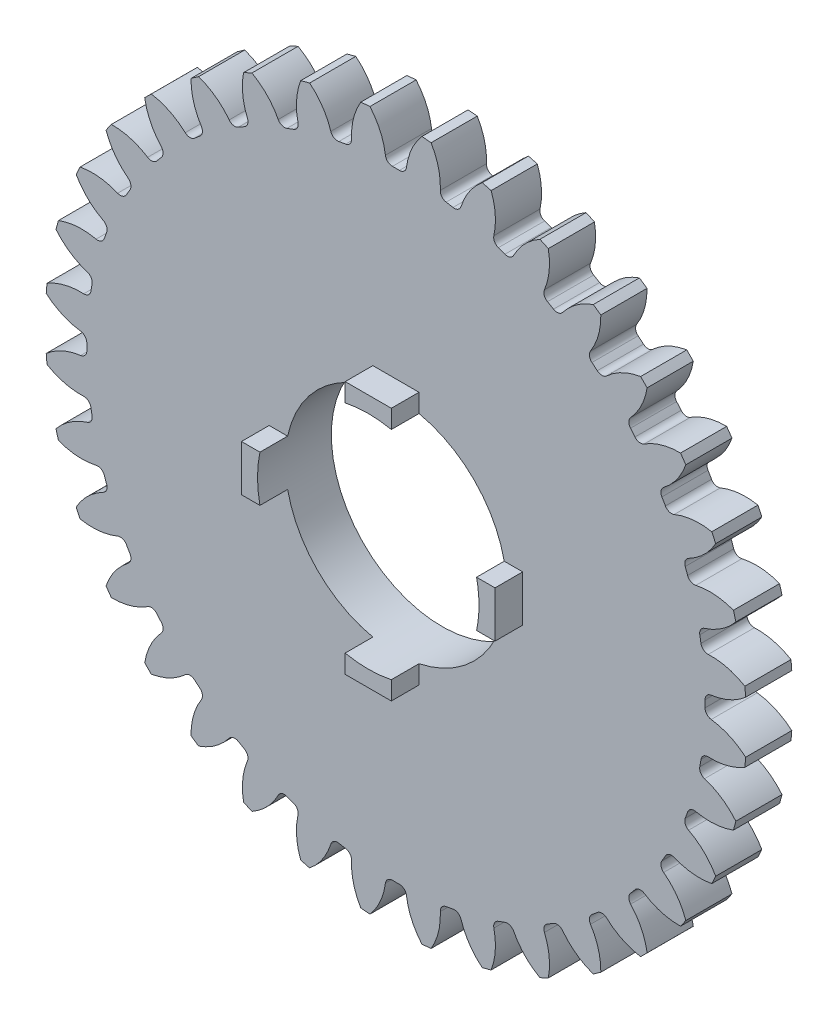
from build123d import *

# Parameters (mm, degrees)
SKETCH1_R                = 38
BOSS_EXTRUDE1_DEPTH      = 5
CUT_EXTRUDE1_DEPTH       = 10
FILLET2_R                = 0.76
CIRPATTERN2_COUNT        = 36
FILLET2_OF_CIRPATTERN2_R = 0.76
SKETCH2_R                = 12
CUT_EXTRUDE2_DEPTH       = 5
BOSS_EXTRUDE2_START      = 3
BOSS_EXTRUDE2_DEPTH      = 3


with BuildPart() as part:
    # Sketch1 → Boss-Extrude1 (new body)
    with BuildSketch(Plane.XY):
        Circle(SKETCH1_R)
    extrude(amount=-BOSS_EXTRUDE1_DEPTH)

    # Sketch1<4> → Cut-Extrude1 (cut)
    with BuildSketch(Plane.XY):
        with BuildLine():
            ThreePointArc((-1.085900353, 33.482395679), (0, 33.5), (1.085900353, 33.482395679))
            ThreePointArc((1.085900353, 33.482395679), (1.570135468, 35.837641415), (2.813544958, 37.8956985))
            ThreePointArc((2.813544958, 37.8956985), (0, 38), (-2.813544958, 37.8956985))
            ThreePointArc((-2.813544958, 37.8956985), (-1.570135468, 35.837641415), (-1.085900353, 33.482395679))
        make_face()
    cut_extrude1 = extrude(amount=-CUT_EXTRUDE1_DEPTH, mode=Mode.SUBTRACT)

    # Fillet2
    fillet2_edges = [part.edges().sort_by_distance(p)[0] for p in [
        (1.085900353, 33.482395679, -2.5),
        (-1.085900353, 33.482395679, -2.5),
    ]]
    fillet(fillet2_edges, radius=FILLET2_R)

    # CirPattern2: Cut-Extrude1 ×36 about axis
    cirpattern2_axis = Axis((0, 0, 0), (0, 0, 1))
    for i in range(1, CIRPATTERN2_COUNT):
        add(cut_extrude1.rotate(cirpattern2_axis, i * 360 / CIRPATTERN2_COUNT), mode=Mode.SUBTRACT)

    # Fillet2 of CirPattern2
    fillet2_of_cirpattern2_edges = [part.edges().sort_by_distance(p)[0] for p in [
        (-4.744753907, 33.162287472, -2.5),
        (-6.883560081, 32.785158237, -2.5),
        (-10.43124122, 31.834559941, -2.5),
        (-12.472066318, 31.091760352, -2.5),
        (-15.800780548, 29.539555415, -2.5),
        (-17.681615132, 28.453655061, -2.5),
        (-20.690221154, 26.347006445, -2.5),
        (-22.353917017, 24.95099986, -2.5),
        (-24.95099986, 22.353917017, -2.5),
        (-26.347006445, 20.690221154, -2.5),
        (-28.453655061, 17.681615132, -2.5),
        (-29.539555415, 15.800780548, -2.5),
        (-31.091760352, 12.472066318, -2.5),
        (-31.834559941, 10.43124122, -2.5),
        (-32.785158237, 6.883560081, -2.5),
        (-33.162287472, 4.744753907, -2.5),
        (-33.482395679, 1.085900353, -2.5),
        (-33.482395679, -1.085900353, -2.5),
        (-33.162287472, -4.744753907, -2.5),
        (-32.785158237, -6.883560081, -2.5),
        (-31.834559941, -10.43124122, -2.5),
        (-31.091760352, -12.472066318, -2.5),
        (-29.539555415, -15.800780548, -2.5),
        (-28.453655061, -17.681615132, -2.5),
        (-26.347006445, -20.690221154, -2.5),
        (-24.95099986, -22.353917017, -2.5),
        (-22.353917017, -24.95099986, -2.5),
        (-20.690221154, -26.347006445, -2.5),
        (-17.681615132, -28.453655061, -2.5),
        (-15.800780548, -29.539555415, -2.5),
        (-12.472066318, -31.091760352, -2.5),
        (-10.43124122, -31.834559941, -2.5),
        (-6.883560081, -32.785158237, -2.5),
        (-4.744753907, -33.162287472, -2.5),
        (-1.085900353, -33.482395679, -2.5),
        (1.085900353, -33.482395679, -2.5),
        (4.744753907, -33.162287472, -2.5),
        (6.883560081, -32.785158237, -2.5),
        (10.43124122, -31.834559941, -2.5),
        (12.472066318, -31.091760352, -2.5),
        (15.800780548, -29.539555415, -2.5),
        (17.681615132, -28.453655061, -2.5),
        (20.690221154, -26.347006445, -2.5),
        (22.353917017, -24.95099986, -2.5),
        (24.95099986, -22.353917017, -2.5),
        (26.347006445, -20.690221154, -2.5),
        (28.453655061, -17.681615132, -2.5),
        (29.539555415, -15.800780548, -2.5),
        (31.091760352, -12.472066318, -2.5),
        (31.834559941, -10.43124122, -2.5),
        (32.785158237, -6.883560081, -2.5),
        (33.162287472, -4.744753907, -2.5),
        (33.482395679, -1.085900353, -2.5),
        (33.482395679, 1.085900353, -2.5),
        (33.162287472, 4.744753907, -2.5),
        (32.785158237, 6.883560081, -2.5),
        (31.834559941, 10.43124122, -2.5),
        (31.091760352, 12.472066318, -2.5),
        (29.539555415, 15.800780548, -2.5),
        (28.453655061, 17.681615132, -2.5),
        (26.347006445, 20.690221154, -2.5),
        (24.95099986, 22.353917017, -2.5),
        (22.353917017, 24.95099986, -2.5),
        (20.690221154, 26.347006445, -2.5),
        (17.681615132, 28.453655061, -2.5),
        (15.800780548, 29.539555415, -2.5),
        (12.472066318, 31.091760352, -2.5),
        (10.43124122, 31.834559941, -2.5),
        (6.883560081, 32.785158237, -2.5),
        (4.744753907, 33.162287472, -2.5),
    ]]
    fillet(fillet2_of_cirpattern2_edges, radius=FILLET2_OF_CIRPATTERN2_R)

    # Sketch2 → Cut-Extrude2 (cut)
    with BuildSketch(Plane.XY):
        Circle(SKETCH2_R)
    extrude(amount=-CUT_EXTRUDE2_DEPTH, mode=Mode.SUBTRACT)

    # Sketch3 → Boss-Extrude2 (add)
    with BuildSketch(Plane.XY.offset(BOSS_EXTRUDE2_START)):
        with BuildLine():
            Line((-2.5, 11.736694594), (-2.5, 13.736694594))
            Line((-2.5, 13.736694594), (2.5, 13.736694594))
            Line((2.5, 13.736694594), (2.5, 11.736694594))
            ThreePointArc((2.5, 11.736694594), (0, 12), (-2.5, 11.736694594))
        make_face()
        with BuildLine():
            Line((13.736694594, -2.5), (11.736694594, -2.5))
            ThreePointArc((11.736694594, -2.5), (12, 0), (11.736694594, 2.5))
            Line((11.736694594, 2.5), (13.736694594, 2.5))
            Line((13.736694594, 2.5), (13.736694594, -2.5))
        make_face()
        with BuildLine():
            Line((-2.5, -13.736694594), (-2.5, -11.736694594))
            ThreePointArc((-2.5, -11.736694594), (0, -12), (2.5, -11.736694594))
            Line((2.5, -11.736694594), (2.5, -13.736694594))
            Line((2.5, -13.736694594), (-2.5, -13.736694594))
        make_face()
        with BuildLine():
            Line((-13.736694594, 2.5), (-11.736694594, 2.5))
            ThreePointArc((-11.736694594, 2.5), (-12, 0), (-11.736694594, -2.5))
            Line((-11.736694594, -2.5), (-13.736694594, -2.5))
            Line((-13.736694594, -2.5), (-13.736694594, 2.5))
        make_face()
    extrude(amount=-BOSS_EXTRUDE2_DEPTH)


solid = part.part
